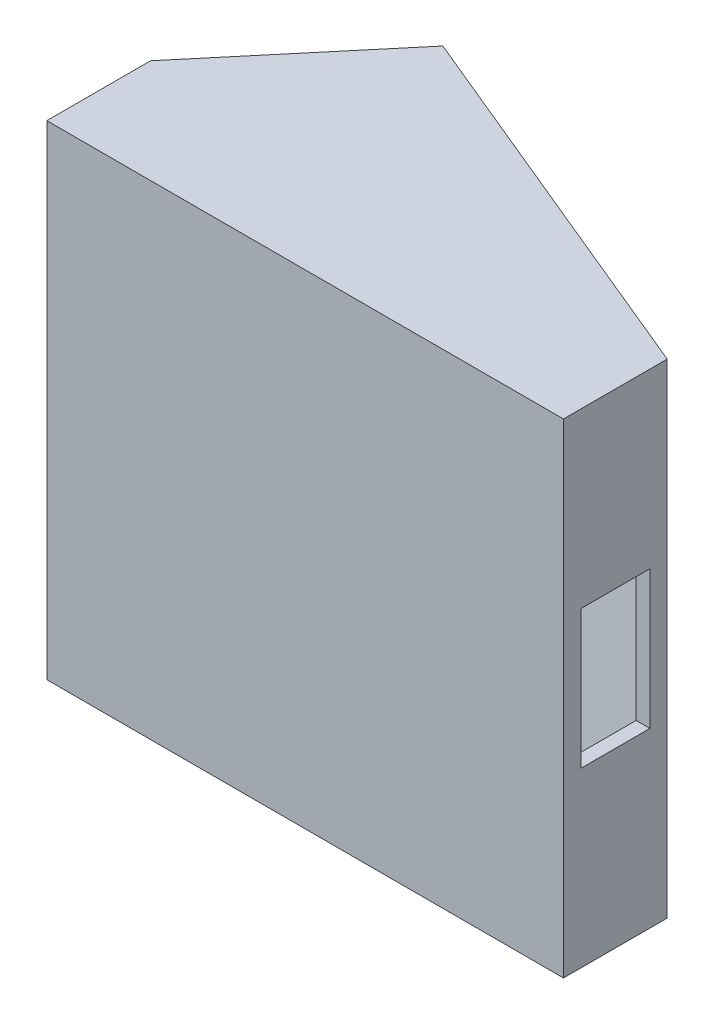
from build123d import *

# Parameters (mm, degrees)
BOSS_EXTRUDE1_DEPTH      = 35
BOSS_EXTRUDE1_DEPTH_BACK = 35
CUT_EXTRUDE1_DEPTH       = 33
CUT_EXTRUDE1_DEPTH_BACK  = 33
CUT_EXTRUDE2_REACH       = 92.823
SKETCH3_W                = 10
SKETCH3_H                = 20
BOSS_EXTRUDE8_DEPTH      = 20
SKETCH5_R                = 1.5
CUT_EXTRUDE3_DEPTH       = 19.999999693


with BuildPart() as part:
    # Sketch1 → Boss-Extrude1 (new, two sides: drawn at the far end of the back side and taken through both)
    with BuildSketch(Plane(origin=(0, 0, 0), x_dir=(1, 0, 0), z_dir=(0, 1, 0)).offset(-BOSS_EXTRUDE1_DEPTH_BACK)):
        Polygon((0, 15), (19.283628291, 37.981333294), (74.707976009, 15), (74.707976009, 0), (0, 0), align=None)
    extrude(amount=BOSS_EXTRUDE1_DEPTH + BOSS_EXTRUDE1_DEPTH_BACK)

    # Sketch2 → Cut-Extrude1 (cut, two sides: drawn at the far end of the back side and taken through both)
    with BuildSketch(Plane(origin=(0, 0, 0), x_dir=(1, 0, 0), z_dir=(0, 1, 0)).offset(-CUT_EXTRUDE1_DEPTH_BACK)):
        Polygon((21.032566766, 35.091034272), (72.707976009, 13.664173121), (72.707976009, 2), (36.573879749, 2), (1.347807304, 16.606254197), (17.935820986, 36.375079097), align=None)
    extrude(amount=CUT_EXTRUDE1_DEPTH + CUT_EXTRUDE1_DEPTH_BACK, mode=Mode.SUBTRACT)

    # Sketch3 → Cut-Extrude2 (cut, up to next)
    with BuildSketch(Plane(origin=(74.707976009, 0, 0), x_dir=(0, 0, -1), z_dir=(1, 0, 0)), mode=Mode.PRIVATE) as cut_extrude2_sk1:
        with Locations((7.5, 0)):
            Rectangle(SKETCH3_W, SKETCH3_H)
    cut_extrude2_tool1 = extrude(cut_extrude2_sk1.sketch, amount=-CUT_EXTRUDE2_REACH, mode=Mode.PRIVATE) & part.part
    add(cut_extrude2_tool1.solids().sort_by_distance((74.707976, 0, -7.5))[0], mode=Mode.SUBTRACT)

    # 3DSketch2 → Boss-Extrude8 (add, along a direction that is not the sketch's normal)
    with BuildSketch(Plane(origin=(17.935820986, -33, -36.375079097), x_dir=(-0.23407626920535343, 0.9313371729360082, 0.2789612347665302), z_dir=(-0.7660444431189789, 0, -0.6427876096865383))):
        with BuildLine():
            Line((0, 0), (2.184948176, -5.588023038))
            ThreePointArc((2.184948176, -5.588023038), (5.496320655, -2.406337312), (5.588023038, 2.184948176))
            Line((5.588023038, 2.184948176), (0, 0))
        make_face()
        with BuildLine():
            Line((61.468253414, 24.034429934), (55.880230376, 21.849481758))
            ThreePointArc((55.880230376, 21.849481758), (59.061916102, 18.538109279), (63.65320159, 18.446406897))
            Line((63.65320159, 18.446406897), (61.468253414, 24.034429934))
        make_face()
        with BuildLine():
            Line((70.865849574, 0), (68.680901398, 5.588023038))
            ThreePointArc((68.680901398, 5.588023038), (65.369528919, 2.406337312), (65.277826536, -2.184948176))
            Line((65.277826536, -2.184948176), (70.865849574, 0))
        make_face()
        with BuildLine():
            Line((9.39759616, -24.034429934), (14.985619198, -21.849481758))
            ThreePointArc((14.985619198, -21.849481758), (11.803933472, -18.538109279), (7.212647984, -18.446406897))
            Line((7.212647984, -18.446406897), (9.39759616, -24.034429934))
        make_face()
    extrude(amount=-BOSS_EXTRUDE8_DEPTH, dir=(-0.9237391286459794, 0, -0.38302222155948973))

    # Sketch5 → Cut-Extrude3 (cut, along a direction that is not the sketch's normal)
    with BuildSketch(Plane(origin=(-7.386058148, 0, -6.197638667), x_dir=(-0.6427876096865378, 0, 0.7660444431189795), z_dir=(-0.7660444431189795, 0, -0.6427876096865378))):
        with Locations((-37.490666647, -31)):
            Circle(SKETCH5_R)
        with Locations((-37.490666647, 31)):
            Circle(SKETCH5_R)
        with Locations((-15.490666647, 31)):
            Circle(SKETCH5_R)
        with Locations((-15.490666647, -31)):
            Circle(SKETCH5_R)
    extrude(amount=-CUT_EXTRUDE3_DEPTH, dir=(-0.9237391286459794, 0, -0.38302222155948973), mode=Mode.SUBTRACT)


solid = part.part
